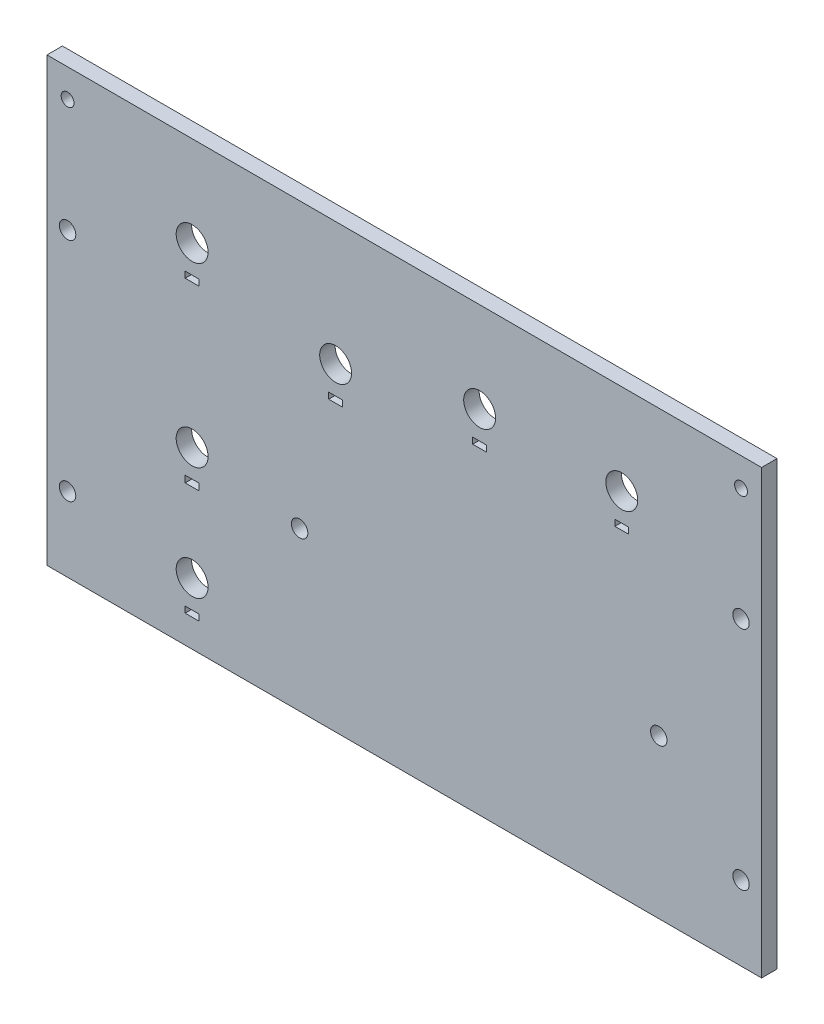
from build123d import *

# Parameters (mm, degrees)
SKETCH1_W           = 139
SKETCH1_H           = 86
SKETCH1_R           = 1.6
SKETCH1_R_2         = 3.1
SKETCH1_R_3         = 1.25
SKETCH1_W_2         = 2.7
SKETCH1_H_2         = 1.2
SKETCH1_H_3         = 1.309440744
BOSS_EXTRUDE1_DEPTH = 3


with BuildPart() as part:
    # Sketch1 → Boss-Extrude1 (new body)
    with BuildSketch(Plane.XY):
        with Locations((69.5, 43)):
            Rectangle(SKETCH1_W, SKETCH1_H)
        with Locations((4, 58.5)):
            Circle(SKETCH1_R, mode=Mode.SUBTRACT)
        with Locations((135, 58.5)):
            Circle(SKETCH1_R, mode=Mode.SUBTRACT)
        with Locations((135, 14.5)):
            Circle(SKETCH1_R, mode=Mode.SUBTRACT)
        with Locations((4, 14.5)):
            Circle(SKETCH1_R, mode=Mode.SUBTRACT)
        with Locations((49.136550625, 30.80578632)):
            Circle(SKETCH1_R, mode=Mode.SUBTRACT)
        with Locations((119, 30.80578632)):
            Circle(SKETCH1_R, mode=Mode.SUBTRACT)
        with Locations((56.141769292, 62)):
            Circle(SKETCH1_R_2, mode=Mode.SUBTRACT)
        with Locations((28.227965057, 11.99453943)):
            Circle(SKETCH1_R_2, mode=Mode.SUBTRACT)
        with Locations((111.806450526, 68.419506212)):
            Circle(SKETCH1_R_2, mode=Mode.SUBTRACT)
        with Locations((84.154646153, 68.419506212)):
            Circle(SKETCH1_R_2, mode=Mode.SUBTRACT)
        with Locations((135, 80.5)):
            Circle(SKETCH1_R_3, mode=Mode.SUBTRACT)
        with Locations((4, 80.5)):
            Circle(SKETCH1_R_3, mode=Mode.SUBTRACT)
        with Locations((28.227965057, 68.419506212)):
            Circle(SKETCH1_R_2, mode=Mode.SUBTRACT)
        with Locations((28.227965057, 33.99453943)):
            Circle(SKETCH1_R_2, mode=Mode.SUBTRACT)
        with Locations((28.227965057, 5.99453943)):
            Rectangle(SKETCH1_W_2, SKETCH1_H_2, mode=Mode.SUBTRACT)
        with Locations((84.154646153, 62.419506212)):
            Rectangle(SKETCH1_W_2, SKETCH1_H_2, mode=Mode.SUBTRACT)
        with Locations((56.141769292, 56)):
            Rectangle(SKETCH1_W_2, SKETCH1_H_2, mode=Mode.SUBTRACT)
        with Locations((111.806450526, 62.419506212)):
            Rectangle(SKETCH1_W_2, SKETCH1_H_2, mode=Mode.SUBTRACT)
        with Locations((28.227965057, 62.419506212)):
            Rectangle(SKETCH1_W_2, SKETCH1_H_2, mode=Mode.SUBTRACT)
        with Locations((28.227965057, 27.99453943)):
            Rectangle(SKETCH1_W_2, SKETCH1_H_3, mode=Mode.SUBTRACT)
    extrude(amount=BOSS_EXTRUDE1_DEPTH)


solid = part.part
